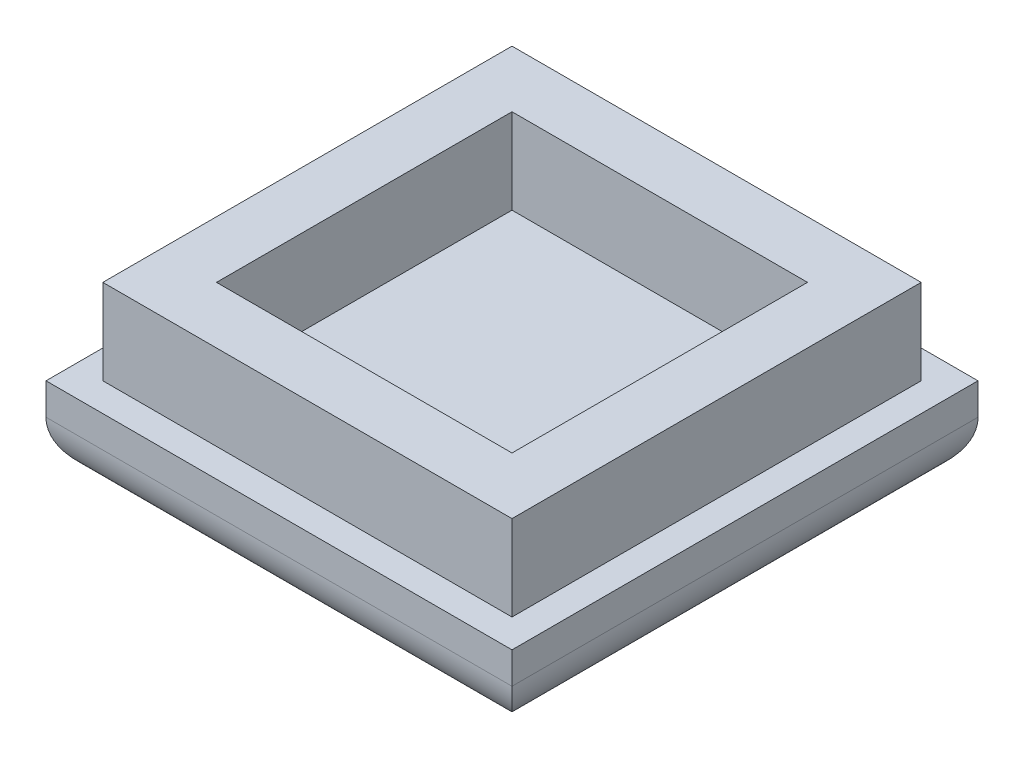
from build123d import *

# Parameters (mm, degrees)
SKETCH1_W                = 22.86
SKETCH1_H                = 22.86
SKETCH1_W_2              = 16.51
SKETCH1_H_2              = 16.51
BOSS_EXTRUDE1_DEPTH      = 6.35
BOSS_EXTRUDE2_DEPTH      = 1.5875
BOSS_EXTRUDE2_DEPTH_BACK = 3.175
SKETCH1_3_W              = 26.035
SKETCH1_3_H              = 26.035
FILLET1_R                = 3
CUT_EXTRUDE1_DEPTH       = 1


with BuildPart() as part:
    # Sketch1 → Boss-Extrude1 (new body)
    with BuildSketch(Plane(origin=(0, 0, 0), x_dir=(1, 0, 0), z_dir=(0, 1, 0))):
        with Locations((-52.595020858, 17.564583421)):
            Rectangle(SKETCH1_W, SKETCH1_H)
        with Locations((-52.595020858, 17.564583421)):
            Rectangle(SKETCH1_W_2, SKETCH1_H_2, mode=Mode.SUBTRACT)
    extrude(amount=BOSS_EXTRUDE1_DEPTH)

    # Sketch1<3> → Boss-Extrude2 (add, two sides: drawn at the far end of the back side and taken through both)
    with BuildSketch(Plane(origin=(0, 0, 0), x_dir=(1, 0, 0), z_dir=(0, 1, 0)).offset(-BOSS_EXTRUDE2_DEPTH_BACK)):
        with Locations((-52.595020858, 17.564583421)):
            Rectangle(SKETCH1_3_W, SKETCH1_3_H)
    extrude(amount=BOSS_EXTRUDE2_DEPTH + BOSS_EXTRUDE2_DEPTH_BACK)

    # Fillet1
    fillet1_edges = [part.edges().sort_by_distance(p)[0] for p in [
        (-52.595020858, -3.175, -30.582083421),
        (-39.577520858, -3.175, -17.564583421),
        (-52.595020858, -3.175, -4.547083421),
        (-65.612520858, -3.175, -17.564583421),
    ]]
    fillet(fillet1_edges, radius=FILLET1_R)

    # Sketch2 → Cut-Extrude1 (cut)
    # profile 1 of 11: a face of its own
    with BuildSketch(Plane(origin=(0, -3.175, 0), x_dir=(-1, 0, 0), z_dir=(0, -1, 0))):
        Polygon((61.670585108, 11.317446295), (62.099645469, 10.888385934), (59.619662063, 8.408402528), (59.190601702, 8.837462889), (60.246191828, 9.893053016), (59.75832624, 10.380918604), (58.702736114, 9.325328477), (58.264963867, 9.763100724), (60.744947273, 12.24308413), (61.18271952, 11.805311883), (60.114061565, 10.736653928), (60.601927153, 10.24878834), align=None)
    # profile 2 of 11: a face of its own
    with BuildSketch(Plane(origin=(0, -3.175, 0), x_dir=(-1, 0, 0), z_dir=(0, -1, 0))):
        with BuildLine():
            Line((57.533893992, 10.494170599), (59.439618945, 12.399895552))
            add(Edge.make_bspline(
                [(59.439618945, 12.399895552), (59.459688752, 12.421082254), (59.497003135, 12.460473201), (59.53880702, 12.524036369), (59.563311492, 12.585968245), (59.568535158, 12.646375535), (59.558096686, 12.703693932), (59.536613876, 12.759246401), (59.502412239, 12.812880033), (59.472604821, 12.844905409), (59.457042716, 12.861625484)],
                knots=[0, 0, 0, 0, 1.316322234, 2.447345534, 3.41587546, 4.293733729, 5.147368164, 6.026382719, 6.969597433, 8, 8, 8, 8], degree=3))
            add(Edge.make_bspline(
                [(59.457042716, 12.861625484), (59.440322641, 12.877187589), (59.408297265, 12.906995006), (59.354663633, 12.941196643), (59.299111165, 12.962679454), (59.241792768, 12.973117926), (59.181385477, 12.967894259), (59.119453601, 12.943389787), (59.055890434, 12.901585903), (59.016499487, 12.86427152), (58.995312785, 12.844201713)],
                knots=[0, 0, 0, 0, 1.030402567, 1.973617281, 2.852631836, 3.706266271, 4.58412454, 5.552654466, 6.683677766, 8, 8, 8, 8], degree=3))
            Line((58.995312785, 12.844201713), (57.089587831, 10.938476759))
            Line((57.089587831, 10.938476759), (56.683759165, 11.344305426))
            Line((56.683759165, 11.344305426), (58.564074453, 13.224620713))
            add(Edge.make_bspline(
                [(58.564074453, 13.224620713), (58.588921111, 13.248443488), (58.637124406, 13.294660416), (58.712814372, 13.356399803), (58.790316214, 13.407214272), (58.867855985, 13.449634045), (58.946284837, 13.482950666), (59.025490454, 13.506143912), (59.10560244, 13.520304318), (59.186260694, 13.524495323), (59.267254695, 13.519726396), (59.347998205, 13.503766125), (59.428749475, 13.479262894), (59.509055675, 13.44401224), (59.588479348, 13.398113279), (59.668265657, 13.343758816), (59.747974755, 13.279479572), (59.798387033, 13.230838223), (59.824393888, 13.205744961)],
                knots=[0, 0, 0, 0, 1.14727371, 2.225746903, 3.250503492, 4.232351556, 5.168772348, 6.085207589, 6.977791315, 7.874557658, 8.771795591, 9.675213844, 10.611738878, 11.579937216, 12.591558839, 13.665587569, 14.795715502, 16, 16, 16, 16], degree=3))
            add(Edge.make_bspline(
                [(59.824393888, 13.205744961), (59.849432066, 13.179693642), (59.898072359, 13.129085176), (59.963186602, 13.049852324), (60.017590078, 12.969654391), (60.063487679, 12.890034475), (60.097355756, 12.809248556), (60.123643636, 12.729090239), (60.138935718, 12.648076575), (60.143910569, 12.566896731), (60.139668498, 12.486224606), (60.125521784, 12.406116339), (60.102324765, 12.326909697), (60.069009196, 12.24848113), (60.026589123, 12.170941278), (59.975774739, 12.093439459), (59.914035328, 12.017749487), (59.867818404, 11.969546193), (59.843995631, 11.944699535)],
                knots=[0, 0, 0, 0, 1.203416841, 2.337811815, 3.411066733, 4.428974454, 5.393279429, 6.323837273, 7.23452427, 8.131115766, 9.027236011, 9.919176652, 10.834951624, 11.770697748, 12.751838415, 13.775856692, 14.853552872, 16, 16, 16, 16], degree=3))
            Line((59.843995631, 11.944699535), (57.963680343, 10.064384248))
            Line((57.963680343, 10.064384248), (57.533893992, 10.494170599))
        make_face()
    # profile 3 of 11: a face of its own
    with BuildSketch(Plane(origin=(0, -3.175, 0), x_dir=(-1, 0, 0), z_dir=(0, -1, 0))):
        with BuildLine():
            Line((56.842041639, 13.358186403), (56.24092154, 13.959306503))
            Line((56.24092154, 13.959306503), (57.030073168, 14.748458131))
            add(Edge.make_bspline(
                [(57.030073168, 14.748458131), (57.054789259, 14.772687403), (57.102898166, 14.819848737), (57.180667887, 14.880210288), (57.257344496, 14.933787257), (57.336312104, 14.975339527), (57.414788388, 15.00983363), (57.494726164, 15.032700063), (57.574904376, 15.047946909), (57.655915561, 15.051988183), (57.737017824, 15.046889099), (57.818223822, 15.032324616), (57.899305093, 15.007288793), (57.979884311, 14.972066464), (58.060287552, 14.927597429), (58.139662012, 14.872166114), (58.219543481, 14.807930681), (58.270196077, 14.759038828), (58.296200528, 14.733938322)],
                knots=[0, 0, 0, 0, 1.147358658, 2.233288893, 3.262152735, 4.246440126, 5.188971764, 6.101088308, 6.9987782, 7.891318535, 8.784328239, 9.689918941, 10.622030606, 11.593030686, 12.602953758, 13.665296831, 14.801390687, 16, 16, 16, 16], degree=3))
            add(Edge.make_bspline(
                [(58.296200528, 14.733938322), (58.321293787, 14.707931467), (58.369935131, 14.65751919), (58.434214408, 14.577810087), (58.488568759, 14.498023794), (58.534468104, 14.418600062), (58.569717413, 14.338294069), (58.594225405, 14.257542068), (58.610168669, 14.176801172), (58.614985746, 14.096039456), (58.610603578, 14.015419933), (58.596909812, 13.935428808), (58.572873616, 13.856371673), (58.541374423, 13.777543906), (58.498206156, 13.700251263), (58.446741684, 13.623535012), (58.385939602, 13.547124614), (58.339694026, 13.499136748), (58.31580227, 13.474344877)],
                knots=[0, 0, 0, 0, 1.205123874, 2.336039497, 3.410816815, 4.42314353, 5.392016695, 6.329194479, 7.233242406, 8.131105707, 9.020436142, 9.92159596, 10.830926874, 11.772371596, 12.747814377, 13.777755865, 14.85192665, 16, 16, 16, 16], degree=3))
            Line((58.31580227, 13.474344877), (57.03370312, 12.192245727))
            add(Edge.make_bspline(
                [(57.03370312, 12.192245727), (57.009228885, 12.168258237), (56.961602301, 12.121578854), (56.884560414, 12.06193412), (56.808596161, 12.009099589), (56.730374995, 11.968196996), (56.652261625, 11.934568911), (56.573002051, 11.911467298), (56.492904069, 11.897283111), (56.412242078, 11.893098451), (56.331249081, 11.897865673), (56.250505299, 11.913826407), (56.169754106, 11.938329508), (56.089447884, 11.973580199), (56.010024217, 12.019479149), (55.930237906, 12.073833615), (55.850528808, 12.138112858), (55.80011653, 12.186754207), (55.774109675, 12.211847469)],
                knots=[0, 0, 0, 0, 1.14214873, 2.222608508, 3.245821863, 4.224503502, 5.16154881, 6.078595237, 6.971774243, 7.869138655, 8.766974973, 9.670995731, 10.60814535, 11.576989398, 12.589285689, 13.664030708, 14.794912343, 16, 16, 16, 16], degree=3))
            add(Edge.make_bspline(
                [(55.774109675, 12.211847469), (55.749070917, 12.237898932), (55.700429495, 12.288507678), (55.635323199, 12.367738561), (55.581010311, 12.447768951), (55.535197761, 12.527338198), (55.499369175, 12.607265781), (55.47356427, 12.687593606), (55.458269399, 12.768080705), (55.452424907, 12.848461656), (55.455758076, 12.928737693), (55.470181309, 13.008247478), (55.492649186, 13.087210156), (55.524800659, 13.165135088), (55.566930022, 13.241930303), (55.617777155, 13.317882511), (55.677826693, 13.39358114), (55.723595427, 13.441084145), (55.747248028, 13.465632991)],
                knots=[0, 0, 0, 0, 1.210226058, 2.351039708, 3.430367357, 4.446980003, 5.423225754, 6.359048915, 7.266924349, 8.161049654, 9.053740444, 9.950727897, 10.861638745, 11.799566459, 12.768140949, 13.791198114, 14.858524016, 16, 16, 16, 16], degree=3))
            Line((55.747248028, 13.465632991), (55.984646908, 13.703031871))
            Line((55.984646908, 13.703031871), (56.390475574, 13.297203205))
            Line((56.390475574, 13.297203205), (56.132748961, 13.039476592))
            add(Edge.make_bspline(
                [(56.132748961, 13.039476592), (56.113159196, 13.018521208), (56.076899718, 12.979734054), (56.036280803, 12.916852043), (56.011933818, 12.855584026), (56.006782777, 12.795192175), (56.01707296, 12.737473301), (56.039504104, 12.682135976), (56.072694933, 12.627703337), (56.102580434, 12.595868221), (56.118229152, 12.579198641)],
                knots=[0, 0, 0, 0, 1.300892313, 2.407873352, 3.381818771, 4.264585546, 5.122993041, 6.02116182, 6.963835982, 8, 8, 8, 8], degree=3))
            add(Edge.make_bspline(
                [(56.118229152, 12.579198641), (56.134943373, 12.563853471), (56.166970103, 12.534450031), (56.22081393, 12.501170728), (56.276357297, 12.479492015), (56.334247783, 12.468988373), (56.395428904, 12.475178463), (56.457792072, 12.500457453), (56.522236204, 12.54184338), (56.561710884, 12.579401295), (56.582863046, 12.599526374)],
                knots=[0, 0, 0, 0, 1.019037727, 1.952615388, 2.82801528, 3.688875922, 4.574973562, 5.553549018, 6.689090715, 8, 8, 8, 8], degree=3))
            Line((56.582863046, 12.599526374), (57.912151575, 13.928814904))
            add(Edge.make_bspline(
                [(57.912151575, 13.928814904), (57.932298819, 13.949952658), (57.969667191, 13.989158195), (58.01050816, 14.053170128), (58.035169907, 14.114873891), (58.040271928, 14.175275023), (58.030116516, 14.232792321), (58.007568374, 14.287649654), (57.974152466, 14.341403975), (57.944467028, 14.373128433), (57.928849356, 14.389818845)],
                knots=[0, 0, 0, 0, 1.319116741, 2.446649622, 3.417235704, 4.296957636, 5.152404308, 6.037294719, 6.967409923, 8, 8, 8, 8], degree=3))
            add(Edge.make_bspline(
                [(57.928849356, 14.389818845), (57.912170351, 14.405444332), (57.880317235, 14.435285469), (57.826083444, 14.468735036), (57.770181471, 14.490174371), (57.712396111, 14.500526512), (57.651371012, 14.495475116), (57.589296818, 14.469919326), (57.52455079, 14.42846781), (57.484868091, 14.390611678), (57.463489472, 14.370217102)],
                knots=[0, 0, 0, 0, 1.023502914, 1.954658345, 2.837923168, 3.696550249, 4.568530314, 5.544566789, 6.677162246, 8, 8, 8, 8], degree=3))
            Line((57.463489472, 14.370217102), (57.002485531, 13.909213161))
            Line((57.002485531, 13.909213161), (57.197776964, 13.713921728))
            Line((57.197776964, 13.713921728), (56.842041639, 13.358186403))
        make_face()
    # profile 4 of 11: a face of its own
    with BuildSketch(Plane(origin=(0, -3.175, 0), x_dir=(-1, 0, 0), z_dir=(0, -1, 0))):
        with BuildLine():
            add(Edge.make_bspline(
                [(55.54199429, 13.683954558), (55.517528275, 13.659956118), (55.469917688, 13.613255427), (55.392654771, 13.553677955), (55.317051304, 13.50029931), (55.239256182, 13.458345092), (55.161839494, 13.42416963), (55.082869574, 13.401230109), (55.00399028, 13.38521607), (54.924190984, 13.380475451), (54.84419722, 13.384596229), (54.764359706, 13.399548776), (54.684196823, 13.423426848), (54.604923289, 13.459295189), (54.525078584, 13.503426546), (54.445296065, 13.557748576), (54.366319756, 13.622609369), (54.315711803, 13.67125531), (54.289660749, 13.696296396)],
                knots=[0, 0, 0, 0, 1.147173076, 2.232385827, 3.264663929, 4.244368267, 5.18870852, 6.094241066, 6.994275667, 7.879878149, 8.764997983, 9.671510092, 10.594907373, 11.560587453, 12.580435735, 13.648644002, 14.789611128, 16, 16, 16, 16], degree=3))
            add(Edge.make_bspline(
                [(54.289660749, 13.696296396), (54.264542535, 13.722287957), (54.215852819, 13.772670591), (54.152038483, 13.852432055), (54.096730164, 13.93112036), (54.053400068, 14.011218241), (54.01731143, 14.090275764), (53.993871423, 14.170575395), (53.978570671, 14.250560791), (53.974506459, 14.330610376), (53.979622869, 14.410505069), (53.994055187, 14.489771413), (54.018803232, 14.568103945), (54.05123652, 14.646344347), (54.094738637, 14.72319952), (54.146841177, 14.799575917), (54.206697341, 14.876504932), (54.253346799, 14.924147492), (54.277318911, 14.948629936)],
                knots=[0, 0, 0, 0, 1.210890748, 2.347218136, 3.420446406, 4.429694985, 5.395775476, 6.327322056, 7.226230598, 8.119816741, 9.005786429, 9.904694971, 10.812960379, 11.754518023, 12.738547904, 13.766688536, 14.85235126, 16, 16, 16, 16], degree=3))
            Line((54.277318911, 14.948629936), (54.35499989, 15.026310915))
            Line((54.35499989, 15.026310915), (54.761554547, 14.619756259))
            Line((54.761554547, 14.619756259), (54.660641873, 14.518843585))
            add(Edge.make_bspline(
                [(54.660641873, 14.518843585), (54.64058594, 14.497635295), (54.603576494, 14.458499392), (54.56173511, 14.395559564), (54.535039888, 14.335484648), (54.527399456, 14.276283814), (54.535529094, 14.219968397), (54.555516993, 14.165161019), (54.589358508, 14.11234324), (54.618499591, 14.080398401), (54.633780226, 14.063647568)],
                knots=[0, 0, 0, 0, 1.333215265, 2.460197613, 3.443029833, 4.313694693, 5.151424605, 6.02356654, 6.963622678, 8, 8, 8, 8], degree=3))
            add(Edge.make_bspline(
                [(54.633780226, 14.063647568), (54.650530933, 14.048366594), (54.682475533, 14.019224863), (54.735294944, 13.985387751), (54.790323734, 13.965301959), (54.846917884, 13.957265404), (54.90652253, 13.965023793), (54.967331431, 13.991486219), (55.030495093, 14.034053878), (55.069921112, 14.071219468), (55.091154215, 14.091235205)],
                knots=[0, 0, 0, 0, 1.031663454, 1.967443832, 2.835618909, 3.680464448, 4.547169169, 5.535721002, 6.672848743, 8, 8, 8, 8], degree=3))
            add(Edge.make_bspline(
                [(55.091154215, 14.091235205), (55.111253566, 14.112422449), (55.150519211, 14.153813375), (55.195956912, 14.224888124), (55.232201607, 14.298573178), (55.253659164, 14.377383329), (55.267711965, 14.458445278), (55.277394902, 14.541837527), (55.280832111, 14.627964336), (55.278100512, 14.747406646), (55.268638113, 14.901706097), (55.249354236, 15.090741893), (55.233736955, 15.283727892), (55.233746758, 15.446650295), (55.243837005, 15.576783872), (55.258888731, 15.674480539), (55.283001918, 15.771191134), (55.311706886, 15.868392255), (55.352574792, 15.964290863), (55.40724858, 16.057840789), (55.474628675, 16.149890784), (55.528714864, 16.206162484), (55.556514099, 16.235085029)],
                knots=[0, 0, 0, 0, 0.767000648, 1.498395328, 2.210679966, 2.920253847, 3.638663826, 4.37583251, 5.128119007, 5.90531385, 7.519650898, 9.195471508, 10.906807209, 12.613870201, 13.476615148, 14.340558435, 15.211889983, 16.098385493, 17.005845838, 17.947598396, 18.945106053, 20, 20, 20, 20], degree=3))
            add(Edge.make_bspline(
                [(55.556514099, 16.235085029), (55.580988405, 16.259072193), (55.628615128, 16.305750942), (55.705656037, 16.365400155), (55.781623723, 16.418218953), (55.859832909, 16.459176459), (55.937774849, 16.492519752), (56.016836584, 16.516342228), (56.096930745, 16.528926236), (56.177485356, 16.53364315), (56.258443446, 16.528543054), (56.339451639, 16.513289352), (56.419611471, 16.486990842), (56.500396962, 16.453125768), (56.580017001, 16.4072273), (56.660214899, 16.352824075), (56.739447761, 16.287709761), (56.790056226, 16.239069478), (56.816107544, 16.214031305)],
                knots=[0, 0, 0, 0, 1.141980649, 2.222281423, 3.2453442, 4.223881813, 5.160789223, 6.069958994, 6.969620469, 7.858793304, 8.756497494, 9.668314678, 10.600027369, 11.565529072, 12.584700043, 13.659286899, 14.795089687, 16, 16, 16, 16], degree=3))
            add(Edge.make_bspline(
                [(56.816107544, 16.214031305), (56.841200804, 16.188024451), (56.889842148, 16.137612173), (56.954121424, 16.05790307), (57.008475775, 15.978116778), (57.05437512, 15.898693046), (57.08962443, 15.818387052), (57.114132421, 15.737635052), (57.130075686, 15.656894155), (57.134892762, 15.57613244), (57.130510595, 15.495512917), (57.116816829, 15.415521791), (57.092780632, 15.336464656), (57.06128144, 15.257636889), (57.018113173, 15.180344246), (56.966648701, 15.103627996), (56.905846619, 15.027217597), (56.859601042, 14.979229731), (56.835709286, 14.95443786)],
                knots=[0, 0, 0, 0, 1.205123874, 2.336039497, 3.410816815, 4.42314353, 5.392016695, 6.329194479, 7.233242406, 8.131105707, 9.020436142, 9.92159596, 10.830926874, 11.772371596, 12.747814377, 13.777755865, 14.85192665, 16, 16, 16, 16], degree=3))
            Line((56.835709286, 14.95443786), (56.683977281, 14.802705854))
            Line((56.683977281, 14.802705854), (56.278148614, 15.20853452))
            Line((56.278148614, 15.20853452), (56.454564296, 15.384950202))
            add(Edge.make_bspline(
                [(56.454564296, 15.384950202), (56.474634103, 15.406136904), (56.511948486, 15.445527851), (56.55375237, 15.509091018), (56.578256842, 15.571022894), (56.583480509, 15.631430185), (56.573042037, 15.688748582), (56.551559226, 15.744301051), (56.517357589, 15.797934682), (56.487550172, 15.829960058), (56.471988067, 15.846680133)],
                knots=[0, 0, 0, 0, 1.316322234, 2.447345534, 3.41587546, 4.293733729, 5.147368164, 6.026382719, 6.969597433, 8, 8, 8, 8], degree=3))
            add(Edge.make_bspline(
                [(56.471988067, 15.846680133), (56.455264982, 15.862234348), (56.423233842, 15.892026652), (56.369448036, 15.926454685), (56.313516318, 15.947598222), (56.256027375, 15.958190669), (56.19558057, 15.952974224), (56.133890817, 15.928347576), (56.069874339, 15.887495219), (56.030669515, 15.850128633), (56.009532145, 15.829982353)],
                knots=[0, 0, 0, 0, 1.029845744, 1.972550751, 2.861289325, 3.714462461, 4.591846342, 5.559852881, 6.684389098, 8, 8, 8, 8], degree=3))
            add(Edge.make_bspline(
                [(56.009532145, 15.829982353), (55.989806869, 15.808704662), (55.951077155, 15.766926849), (55.904353424, 15.696798675), (55.869663767, 15.622274983), (55.846718587, 15.544010317), (55.833078655, 15.462742357), (55.823173488, 15.379147416), (55.820106805, 15.292772018), (55.821260617, 15.17307655), (55.831554885, 15.018787072), (55.850472451, 14.829750443), (55.866542182, 14.636516186), (55.865374364, 14.473609772), (55.855467445, 14.343446169), (55.839943247, 14.24592466), (55.817540608, 14.148531576), (55.78723013, 14.051529669), (55.746710201, 13.955480803), (55.692061542, 13.861673246), (55.623609763, 13.770050413), (55.569707646, 13.713189273), (55.54199429, 13.683954558)],
                knots=[0, 0, 0, 0, 0.762027162, 1.496206889, 2.205076934, 2.915744009, 3.633441388, 4.369878865, 5.127776778, 5.904122481, 7.516858247, 9.19101659, 10.900654794, 12.612423242, 13.467970321, 14.331056651, 15.206255758, 16.093767336, 17.000327559, 17.941145981, 18.941456145, 20, 20, 20, 20], degree=3))
        make_face()
    # profile 5 of 11: a face of its own
    with BuildSketch(Plane(origin=(0, -3.175, 0), x_dir=(-1, 0, 0), z_dir=(0, -1, 0))):
        Polygon((54.533439128, 18.454592275), (54.966855431, 18.021175971), (54.606764164, 17.512982651), (55.133833237, 16.985913578), (55.642026558, 17.346004845), (56.036239377, 16.951792026), (53.119209715, 14.908854876), (52.490501978, 15.537562613), align=None)
        Polygon((54.722922637, 16.685353528), (54.309834066, 17.098442099), (53.276023654, 15.650817125), align=None, mode=Mode.SUBTRACT)
    # profile 6 of 11: a face of its own
    with BuildSketch(Plane(origin=(0, -3.175, 0), x_dir=(-1, 0, 0), z_dir=(0, -1, 0))):
        Polygon((51.865981731, 16.16208286), (51.43692137, 16.591143221), (53.561169451, 18.715391303), (52.854780735, 19.421780019), (53.21051606, 19.777515343), (54.345965137, 18.642066266), align=None)
    # profile 7 of 11: a face of its own
    with BuildSketch(Plane(origin=(0, -3.175, 0), x_dir=(-1, 0, 0), z_dir=(0, -1, 0))):
        with BuildLine():
            add(Edge.make_bspline(
                [(51.185588294, 18.040360554), (51.160703861, 18.016820494), (51.112314865, 17.9710457), (51.036739421, 17.909127809), (50.959096649, 17.858506686), (50.880530144, 17.817237793), (50.801530487, 17.785265882), (50.721369924, 17.761921643), (50.640056501, 17.749940346), (50.558007887, 17.746991933), (50.475783309, 17.75323809), (50.393966487, 17.77074637), (50.312171583, 17.795854843), (50.231152523, 17.831874259), (50.151338531, 17.878368794), (50.070922098, 17.932989604), (49.99107729, 17.997650023), (49.940397442, 18.046499429), (49.914379001, 18.071578143)],
                knots=[0, 0, 0, 0, 1.133907579, 2.204938675, 3.229318695, 4.196858228, 5.138579502, 6.046466581, 6.954035468, 7.851898979, 8.7600688, 9.676084955, 10.616169044, 11.588242108, 12.603812259, 13.670429561, 14.804025771, 16, 16, 16, 16], degree=3))
            add(Edge.make_bspline(
                [(49.914379001, 18.071578143), (49.889271518, 18.097578345), (49.840366075, 18.148222666), (49.776015553, 18.228425262), (49.719893059, 18.308161471), (49.675243176, 18.38938426), (49.637662924, 18.469858619), (49.612897049, 18.551928462), (49.595293051, 18.633698768), (49.589072045, 18.715935569), (49.592013797, 18.797980946), (49.603996891, 18.879295242), (49.627340643, 18.959455568), (49.659312689, 19.038455291), (49.700581544, 19.117021778), (49.751202679, 19.194664555), (49.813120566, 19.270239998), (49.858895361, 19.318628994), (49.882435421, 19.343513427)],
                knots=[0, 0, 0, 0, 1.195165573, 2.327995304, 3.398421992, 4.416332529, 5.391009061, 6.330457513, 7.245854306, 8.15341007, 9.050666491, 9.957621728, 10.86489494, 11.80597947, 12.772864803, 13.79655219, 14.866859111, 16, 16, 16, 16], degree=3))
            Line((49.882435421, 19.343513427), (51.16453457, 20.625612576))
            add(Edge.make_bspline(
                [(51.16453457, 20.625612576), (51.189381232, 20.649198965), (51.237833606, 20.695193738), (51.313933493, 20.756448611), (51.391340561, 20.807487704), (51.469239877, 20.849755445), (51.548983342, 20.880632557), (51.629015495, 20.903909917), (51.710300648, 20.916092156), (51.792115992, 20.918966788), (51.874340758, 20.912741415), (51.956150421, 20.895215631), (52.037974875, 20.870157917), (52.119069505, 20.83385755), (52.199636674, 20.787938484), (52.279666857, 20.732114807), (52.359813316, 20.667659492), (52.410465575, 20.61876887), (52.436469854, 20.593668996)],
                knots=[0, 0, 0, 0, 1.133085894, 2.209580605, 3.226528308, 4.197104868, 5.135176377, 6.050108534, 6.949105488, 7.846318363, 8.75383008, 9.669182444, 10.608585302, 11.579953954, 12.601742946, 13.672117682, 14.804892433, 16, 16, 16, 16], degree=3))
            add(Edge.make_bspline(
                [(52.436469854, 20.593668996), (52.461548568, 20.567650554), (52.510397976, 20.516970706), (52.575058386, 20.4371259), (52.629679227, 20.356709463), (52.676173656, 20.276895482), (52.712193443, 20.195876383), (52.737300598, 20.114081618), (52.75481363, 20.032264298), (52.761042354, 19.950041545), (52.758166837, 19.868225669), (52.745984835, 19.786940658), (52.72270741, 19.706908467), (52.691830316, 19.627165012), (52.64956257, 19.549265693), (52.598523478, 19.471858626), (52.537268606, 19.395758739), (52.491273833, 19.347306365), (52.467687443, 19.322459703)],
                knots=[0, 0, 0, 0, 1.195966057, 2.32955452, 3.396164534, 4.411727745, 5.383794166, 6.323871831, 7.239881727, 8.148045342, 9.045902717, 9.945545454, 10.86113484, 11.799880199, 12.77115396, 13.788832174, 14.866100169, 16, 16, 16, 16], degree=3))
            Line((52.467687443, 19.322459703), (51.185588294, 18.040360554))
        make_face()
        with BuildLine():
            add(Edge.make_bspline(
                [(52.060406796, 19.773299778), (52.080513265, 19.794460422), (52.118036449, 19.833950935), (52.159475553, 19.898029606), (52.184025872, 19.960373444), (52.19000563, 20.021108091), (52.180548849, 20.079348364), (52.158889328, 20.135172982), (52.125481076, 20.189187749), (52.096078991, 20.221217745), (52.080734529, 20.237933671)],
                knots=[0, 0, 0, 0, 1.311825649, 2.448161124, 3.413382531, 4.300099579, 5.159838166, 6.046019676, 6.980249935, 8, 8, 8, 8], degree=3))
            add(Edge.make_bspline(
                [(52.080734529, 20.237933671), (52.064080083, 20.253603319), (52.032123185, 20.283670566), (51.977349502, 20.31659804), (51.921446366, 20.338509574), (51.863176645, 20.347921049), (51.802450183, 20.341953886), (51.740103856, 20.317399736), (51.676025996, 20.275961881), (51.636535357, 20.238438502), (51.615374645, 20.218331929)],
                knots=[0, 0, 0, 0, 1.024778864, 1.966367106, 2.850733052, 3.708710249, 4.593610636, 5.556854546, 6.690861953, 8, 8, 8, 8], degree=3))
            Line((51.615374645, 20.218331929), (50.288990078, 18.891947361))
            add(Edge.make_bspline(
                [(50.288990078, 18.891947361), (50.26883194, 18.870816706), (50.231443361, 18.831624337), (50.19056303, 18.767263687), (50.165355837, 18.705243416), (50.159190112, 18.644062883), (50.169645601, 18.586144964), (50.191575473, 18.530521564), (50.224375074, 18.475919675), (50.25444387, 18.443966154), (50.270114326, 18.427313468)],
                knots=[0, 0, 0, 0, 1.310681894, 2.431004975, 3.409410687, 4.295354624, 5.156065941, 6.031313986, 6.974012629, 8, 8, 8, 8], degree=3))
            add(Edge.make_bspline(
                [(50.270114326, 18.427313468), (50.286828558, 18.41196828), (50.318855309, 18.382564806), (50.372698986, 18.349285736), (50.428242878, 18.327606214), (50.48613144, 18.317105531), (50.547320185, 18.323283897), (50.609337944, 18.348487222), (50.673699398, 18.389368792), (50.712891641, 18.426757177), (50.734022229, 18.44691521)],
                knots=[0, 0, 0, 0, 1.020955113, 1.956289361, 2.833336374, 3.695816782, 4.583581672, 5.563998381, 6.686624154, 8, 8, 8, 8], degree=3))
            Line((50.734022229, 18.44691521), (52.060406796, 19.773299778))
        make_face(mode=Mode.SUBTRACT)
    # profile 8 of 11: a face of its own
    with BuildSketch(Plane(origin=(0, -3.175, 0), x_dir=(-1, 0, 0), z_dir=(0, -1, 0))):
        Polygon((49.132503831, 18.89556076), (47.805393273, 20.222671317), (48.161128598, 20.578406642), (48.609790701, 20.129744539), (50.734038783, 22.25399262), (51.163825134, 21.824206269), (49.039577053, 19.699958187), (49.488239156, 19.251296084), align=None)
    # profile 9 of 11: a face of its own
    with BuildSketch(Plane(origin=(0, -3.175, 0), x_dir=(-1, 0, 0), z_dir=(0, -1, 0))):
        with BuildLine():
            add(Edge.make_bspline(
                [(46.980157721, 21.04790687), (46.953365171, 21.075361429), (46.901718269, 21.128284458), (46.833541909, 21.211079215), (46.774011066, 21.291127938), (46.726060954, 21.370927085), (46.686777086, 21.448422371), (46.658820314, 21.525471972), (46.641219686, 21.601034532), (46.63347765, 21.675744225), (46.636896499, 21.749399079), (46.64836843, 21.822848659), (46.670049911, 21.89606126), (46.700269092, 21.969324875), (46.741347446, 22.041630321), (46.790011459, 22.114447614), (46.848115894, 22.187263991), (46.892631539, 22.233092299), (46.91554457, 22.256680983)],
                knots=[0, 0, 0, 0, 1.318386336, 2.541399316, 3.684745976, 4.744992425, 5.738527574, 6.667643156, 7.555726897, 8.400215173, 9.24125319, 10.08389487, 10.950235342, 11.860379702, 12.802702176, 13.804253333, 14.869808293, 16, 16, 16, 16], degree=3))
            Line((46.91554457, 22.256680983), (47.004115406, 22.345251819))
            add(Edge.make_bspline(
                [(47.004115406, 22.345251819), (47.035385582, 22.375322694), (47.095261242, 22.432901953), (47.192164909, 22.503327287), (47.287526858, 22.559601977), (47.38465582, 22.597045143), (47.482679238, 22.618573959), (47.582295252, 22.620129518), (47.683749023, 22.605190254), (47.74883626, 22.581212933), (47.782377178, 22.56885688)],
                knots=[0, 0, 0, 0, 1.20154288, 2.300696178, 3.313575485, 4.26310816, 5.175102971, 6.081178972, 7.011188364, 8, 8, 8, 8], degree=3))
            add(Edge.make_bspline(
                [(47.782377178, 22.56885688), (47.773320074, 22.588317171), (47.755698822, 22.626178577), (47.735580259, 22.684132829), (47.719513935, 22.740930722), (47.711357161, 22.797309843), (47.70753358, 22.852645947), (47.708533067, 22.907226549), (47.716948483, 22.960920984), (47.734704445, 23.032050267), (47.770055337, 23.1195186), (47.827559063, 23.222446765), (47.902104958, 23.32355563), (47.961475013, 23.386453358), (47.99218842, 23.418991707)],
                knots=[0, 0, 0, 0, 0.816703964, 1.588956691, 2.333219889, 3.060347421, 3.752912374, 4.444189061, 5.133498048, 5.817304591, 7.232297381, 8.708913543, 10.297450117, 12, 12, 12, 12], degree=3))
            Line((47.99218842, 23.418991707), (48.194013768, 23.620817054))
            add(Edge.make_bspline(
                [(48.194013768, 23.620817054), (48.217613253, 23.643477342), (48.263466278, 23.687505536), (48.336467608, 23.745334647), (48.410853916, 23.79322159), (48.485496017, 23.833238038), (48.561798415, 23.862067049), (48.638251903, 23.883231751), (48.716184154, 23.892966761), (48.794583514, 23.894656278), (48.873900162, 23.886679263), (48.953376903, 23.867911613), (49.033470184, 23.840584426), (49.113030406, 23.801862741), (49.19310086, 23.754436587), (49.273603311, 23.697554648), (49.354710141, 23.631392151), (49.406070715, 23.581304393), (49.43255349, 23.555477913)],
                knots=[0, 0, 0, 0, 1.107368409, 2.151580398, 3.147044195, 4.099952097, 5.012957072, 5.903364661, 6.779443922, 7.664519794, 8.554022114, 9.470330168, 10.423907161, 11.413452069, 12.460360957, 13.571965217, 14.748045538, 16, 16, 16, 16], degree=3))
            Line((49.43255349, 23.555477913), (50.107724616, 22.880306787))
            Line((50.107724616, 22.880306787), (47.62774121, 20.400323381))
            Line((47.62774121, 20.400323381), (46.980157721, 21.04790687))
        make_face()
        with BuildLine():
            Line((48.563542911, 22.194245804), (49.322928931, 22.953631823))
            Line((49.322928931, 22.953631823), (49.076818165, 23.199742588))
            add(Edge.make_bspline(
                [(49.076818165, 23.199742588), (49.059128086, 23.216249229), (49.025426221, 23.247696491), (48.970366085, 23.284145452), (48.914096736, 23.305791702), (48.857263023, 23.316015535), (48.797532242, 23.307658858), (48.736403236, 23.2812884), (48.672290738, 23.23760026), (48.631946506, 23.199440889), (48.6100063, 23.178688865)],
                knots=[0, 0, 0, 0, 1.072474451, 2.043201041, 2.906413654, 3.73237701, 4.57655625, 5.53941582, 6.661872532, 8, 8, 8, 8], degree=3))
            Line((48.6100063, 23.178688865), (48.395113125, 22.963795689))
            add(Edge.make_bspline(
                [(48.395113125, 22.963795689), (48.381376505, 22.949688822), (48.355056046, 22.922658939), (48.320082354, 22.881020891), (48.290482489, 22.841136824), (48.264794252, 22.80323981), (48.246223345, 22.765736071), (48.232773988, 22.729708671), (48.224594234, 22.695331613), (48.220231533, 22.650679087), (48.230622588, 22.593248661), (48.260498601, 22.524536063), (48.307974593, 22.453511226), (48.349599433, 22.409478328), (48.37188143, 22.385907285)],
                knots=[0, 0, 0, 0, 1.046923348, 2.005988596, 2.888886081, 3.688495627, 4.436738637, 5.108581288, 5.72982539, 6.311266615, 7.483512426, 8.781423071, 10.277078709, 12, 12, 12, 12], degree=3))
            Line((48.37188143, 22.385907285), (48.563542911, 22.194245804))
        make_face(mode=Mode.SUBTRACT)
        with BuildLine():
            Line((47.554416174, 21.185119066), (48.207807586, 21.838510479))
            Line((48.207807586, 21.838510479), (48.0393778, 22.006940265))
            add(Edge.make_bspline(
                [(48.0393778, 22.006940265), (48.019828083, 22.025488076), (47.982626313, 22.060783286), (47.920832416, 22.101489346), (47.858200658, 22.12842784), (47.794132037, 22.142041868), (47.727087676, 22.137498465), (47.658536316, 22.111448334), (47.588223131, 22.065596811), (47.54456848, 22.024663997), (47.521020613, 22.002584323)],
                knots=[0, 0, 0, 0, 1.078981067, 2.053226932, 2.948925843, 3.799551934, 4.655419488, 5.603808803, 6.707464357, 8, 8, 8, 8], degree=3))
            Line((47.521020613, 22.002584323), (47.383082426, 21.864646135))
            add(Edge.make_bspline(
                [(47.383082426, 21.864646135), (47.362614256, 21.843156168), (47.324719369, 21.80336952), (47.280450608, 21.739717651), (47.251736571, 21.678629355), (47.238968546, 21.618653284), (47.242422662, 21.559683964), (47.264158134, 21.502561551), (47.297824772, 21.44447307), (47.330228001, 21.410268114), (47.347508893, 21.392026347)],
                knots=[0, 0, 0, 0, 1.30075512, 2.408225472, 3.3872352, 4.243156782, 5.073127188, 5.939589026, 6.901166919, 8, 8, 8, 8], degree=3))
            Line((47.347508893, 21.392026347), (47.554416174, 21.185119066))
        make_face(mode=Mode.SUBTRACT)
    # profile 10 of 11: a face of its own
    with BuildSketch(Plane(origin=(0, -3.175, 0), x_dir=(-1, 0, 0), z_dir=(0, -1, 0))):
        with BuildLine():
            add(Edge.make_bspline(
                [(46.684511152, 22.541437696), (46.659626719, 22.517897636), (46.611237724, 22.472122841), (46.535662279, 22.410204951), (46.458019508, 22.359583828), (46.379453002, 22.318314934), (46.300453345, 22.286343024), (46.220292782, 22.262998785), (46.13897936, 22.251017488), (46.056930746, 22.248069075), (45.974706167, 22.254315232), (45.892889345, 22.271823512), (45.811094441, 22.296931985), (45.730075381, 22.332951401), (45.65026139, 22.379445936), (45.569844956, 22.434066746), (45.490000148, 22.498727165), (45.439320301, 22.547576571), (45.413301859, 22.572655285)],
                knots=[0, 0, 0, 0, 1.133907579, 2.204938675, 3.229318695, 4.196858228, 5.138579502, 6.046466581, 6.954035468, 7.851898979, 8.7600688, 9.676084955, 10.616169044, 11.588242108, 12.603812259, 13.670429561, 14.804025771, 16, 16, 16, 16], degree=3))
            add(Edge.make_bspline(
                [(45.413301859, 22.572655285), (45.388194376, 22.598655487), (45.339288933, 22.649299808), (45.274938412, 22.729502404), (45.218815917, 22.809238613), (45.174166035, 22.890461402), (45.136585782, 22.97093576), (45.111819907, 23.053005604), (45.094215909, 23.13477591), (45.087994904, 23.217012711), (45.090936656, 23.299058088), (45.102919749, 23.380372383), (45.126263501, 23.46053271), (45.158235548, 23.539532433), (45.199504402, 23.61809892), (45.250125537, 23.695741697), (45.312043424, 23.77131714), (45.35781822, 23.819706135), (45.381358279, 23.844590568)],
                knots=[0, 0, 0, 0, 1.195165573, 2.327995304, 3.398421992, 4.416332529, 5.391009061, 6.330457513, 7.245854306, 8.15341007, 9.050666491, 9.957621728, 10.86489494, 11.80597947, 12.772864803, 13.79655219, 14.866859111, 16, 16, 16, 16], degree=3))
            Line((45.381358279, 23.844590568), (46.663457428, 25.126689718))
            add(Edge.make_bspline(
                [(46.663457428, 25.126689718), (46.68830409, 25.150276107), (46.736756464, 25.19627088), (46.812856351, 25.257525753), (46.890263419, 25.308564846), (46.968162735, 25.350832587), (47.0479062, 25.381709699), (47.127938353, 25.404987058), (47.209223506, 25.417169298), (47.291038851, 25.42004393), (47.373263616, 25.413818557), (47.455073279, 25.396292773), (47.536897733, 25.371235059), (47.617992364, 25.334934692), (47.698559532, 25.289015625), (47.778589715, 25.233191949), (47.858736174, 25.168736634), (47.909388434, 25.119846012), (47.935392712, 25.094746138)],
                knots=[0, 0, 0, 0, 1.133085894, 2.209580605, 3.226528308, 4.197104868, 5.135176377, 6.050108534, 6.949105488, 7.846318363, 8.75383008, 9.669182444, 10.608585302, 11.579953954, 12.601742946, 13.672117682, 14.804892433, 16, 16, 16, 16], degree=3))
            add(Edge.make_bspline(
                [(47.935392712, 25.094746138), (47.960471426, 25.068727696), (48.009320834, 25.018047848), (48.073981244, 24.938203041), (48.128602085, 24.857786605), (48.175096514, 24.777972624), (48.211116301, 24.696953525), (48.236223456, 24.61515876), (48.253736488, 24.53334144), (48.259965212, 24.451118687), (48.257089695, 24.369302811), (48.244907693, 24.2880178), (48.221630269, 24.207985608), (48.190753174, 24.128242154), (48.148485428, 24.050342835), (48.097446336, 23.972935768), (48.036191464, 23.896835881), (47.990196691, 23.848383507), (47.966610301, 23.823536845)],
                knots=[0, 0, 0, 0, 1.195966057, 2.32955452, 3.396164534, 4.411727745, 5.383794166, 6.323871831, 7.239881727, 8.148045342, 9.045902717, 9.945545454, 10.86113484, 11.799880199, 12.77115396, 13.788832174, 14.866100169, 16, 16, 16, 16], degree=3))
            Line((47.966610301, 23.823536845), (46.684511152, 22.541437696))
        make_face()
        with BuildLine():
            add(Edge.make_bspline(
                [(47.559329654, 24.27437692), (47.579436123, 24.295537564), (47.616959307, 24.335028077), (47.658398411, 24.399106748), (47.68294873, 24.461450586), (47.688928488, 24.522185233), (47.679471707, 24.580425506), (47.657812186, 24.636250124), (47.624403934, 24.69026489), (47.595001849, 24.722294887), (47.579657387, 24.739010813)],
                knots=[0, 0, 0, 0, 1.311825649, 2.448161124, 3.413382531, 4.300099579, 5.159838166, 6.046019676, 6.980249935, 8, 8, 8, 8], degree=3))
            add(Edge.make_bspline(
                [(47.579657387, 24.739010813), (47.563002941, 24.754680461), (47.531046043, 24.784747708), (47.47627236, 24.817675181), (47.420369224, 24.839586716), (47.362099503, 24.848998191), (47.301373041, 24.843031028), (47.239026714, 24.818476878), (47.174948854, 24.777039023), (47.135458215, 24.739515644), (47.114297503, 24.719409071)],
                knots=[0, 0, 0, 0, 1.024778864, 1.966367106, 2.850733052, 3.708710249, 4.593610636, 5.556854546, 6.690861953, 8, 8, 8, 8], degree=3))
            Line((47.114297503, 24.719409071), (45.787912936, 23.393024503))
            add(Edge.make_bspline(
                [(45.787912936, 23.393024503), (45.767754798, 23.371893848), (45.730366219, 23.332701479), (45.689485888, 23.268340829), (45.664278695, 23.206320558), (45.65811297, 23.145140024), (45.668568459, 23.087222105), (45.690498331, 23.031598706), (45.723297932, 22.976996817), (45.753366729, 22.945043296), (45.769037184, 22.92839061)],
                knots=[0, 0, 0, 0, 1.310681894, 2.431004975, 3.409410687, 4.295354624, 5.156065941, 6.031313986, 6.974012629, 8, 8, 8, 8], degree=3))
            add(Edge.make_bspline(
                [(45.769037184, 22.92839061), (45.785751416, 22.913045422), (45.817778167, 22.883641948), (45.871621844, 22.850362878), (45.927165736, 22.828683356), (45.985054298, 22.818182673), (46.046243043, 22.824361039), (46.108260802, 22.849564364), (46.172622256, 22.890445934), (46.211814499, 22.927834319), (46.232945087, 22.947992352)],
                knots=[0, 0, 0, 0, 1.020955113, 1.956289361, 2.833336374, 3.695816782, 4.583581672, 5.563998381, 6.686624154, 8, 8, 8, 8], degree=3))
            Line((46.232945087, 22.947992352), (47.559329654, 24.27437692))
        make_face(mode=Mode.SUBTRACT)
    # profile 11 of 11: a face of its own
    with BuildSketch(Plane(origin=(0, -3.175, 0), x_dir=(-1, 0, 0), z_dir=(0, -1, 0))):
        Polygon((44.63142669, 23.396637901), (43.304316132, 24.723748459), (43.660051456, 25.079483784), (44.10871356, 24.630821681), (46.232961641, 26.755069762), (46.662747992, 26.325283411), (44.538499911, 24.201035329), (44.987162014, 23.752373226), align=None)
    extrude(amount=-CUT_EXTRUDE1_DEPTH, mode=Mode.SUBTRACT)


solid = part.part
